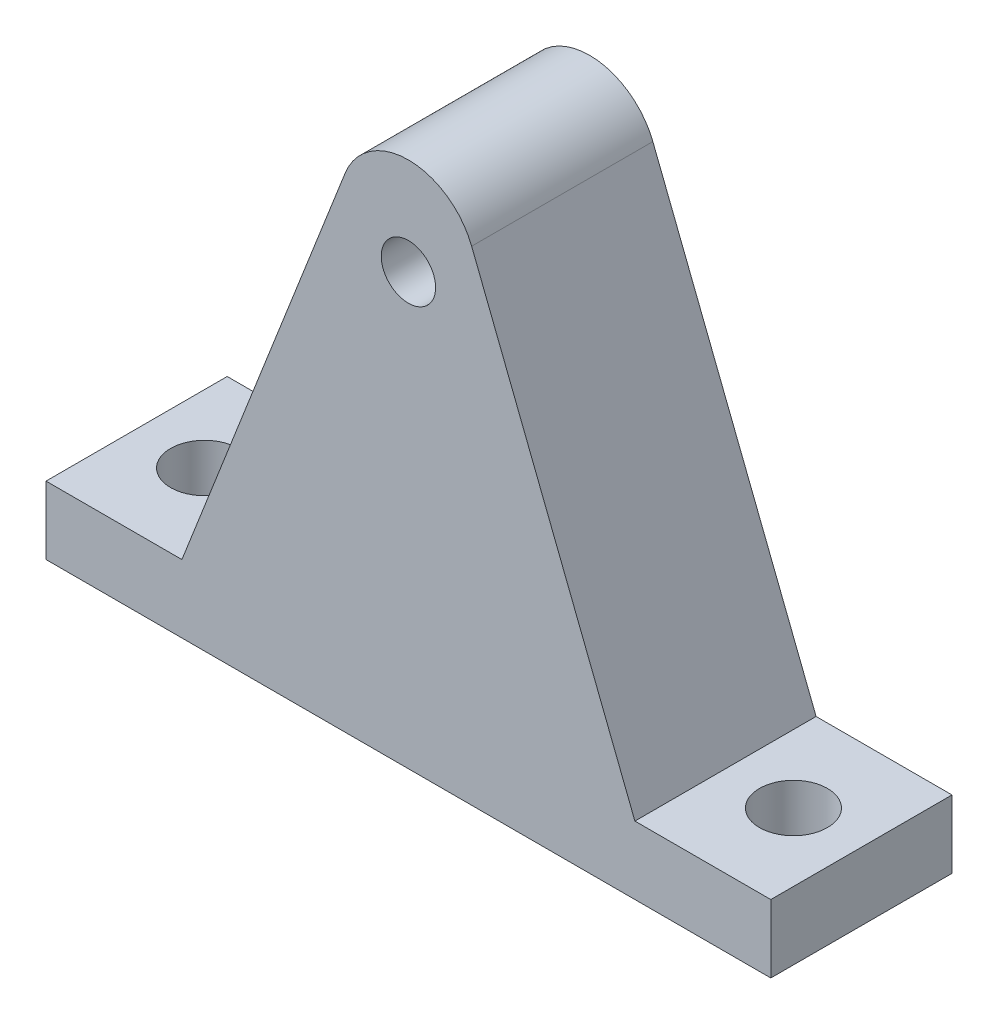
from build123d import *

# Parameters (mm, degrees)
ESQUISSE1_R             = 1.2
BOSS_EXTRU_1_DEPTH      = 8
ESQUISSE2_R             = 1.5
ENL_V_MAT_EXTRU_1_DEPTH = 39.721703123


with BuildPart() as part:
    # Esquisse1 → Boss.-Extru.1 (new body)
    with BuildSketch(Plane.XY):
        with BuildLine():
            Line((0, 0), (32, 0))
            Line((32, 0), (32, 3))
            Line((32, 3), (26, 3))
            Line((26, 3), (18.792908921, 21.37755528))
            ThreePointArc((18.792908921, 21.37755528), (16, 23.282265473), (13.207091079, 21.37755528))
            Line((13.207091079, 21.37755528), (6, 3))
            Line((6, 3), (0, 3))
            Line((0, 3), (0, 0))
        make_face()
        with Locations((16, 19)):
            Circle(ESQUISSE1_R, mode=Mode.SUBTRACT)
    extrude(amount=BOSS_EXTRU_1_DEPTH)

    # Esquisse2 → Enlèv. mat.-Extru.1 (cut, through all)
    with BuildSketch(Plane(origin=(0, 3, 0), x_dir=(1, 0, 0), z_dir=(0, 1, 0))):
        with Locations(Location((3, -4, 0), (0, 0, 180))):
            Circle(ESQUISSE2_R)
        with Locations((29, -4)):
            Circle(ESQUISSE2_R)
    extrude(amount=-ENL_V_MAT_EXTRU_1_DEPTH, mode=Mode.SUBTRACT)


solid = part.part
